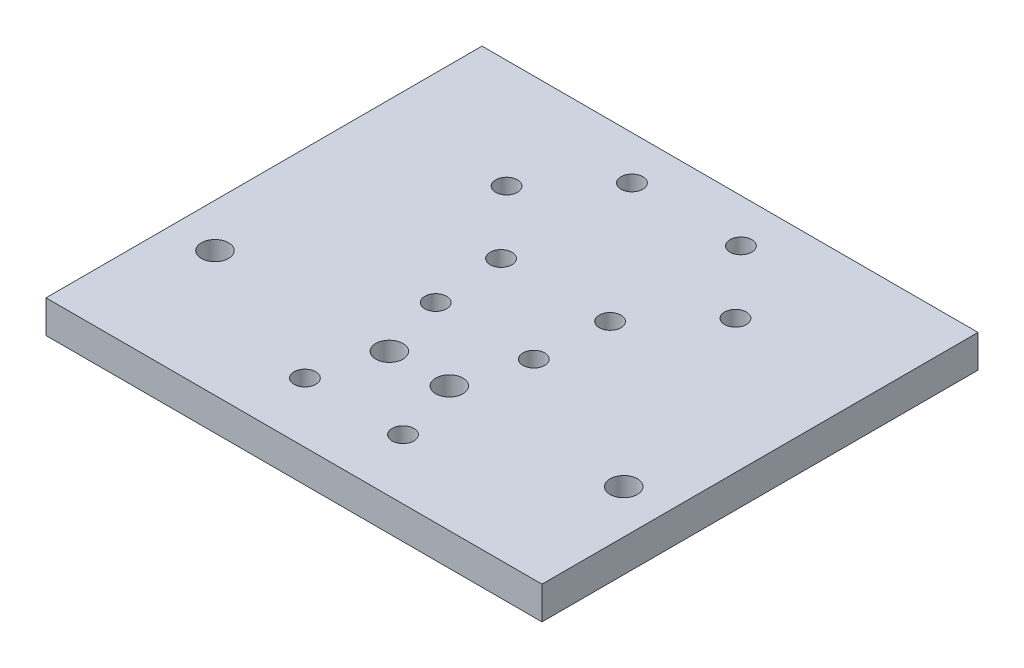
from build123d import *

# Parameters (mm, degrees)
EXTRUDE_1_DEPTH     = 104
SKETCH_2_R          = 2
SKETCH_2_R_2        = 2.5
SKETCH_2_W          = 6.5
SKETCH_2_H          = 80
CUT_EXTRUDE_1_DEPTH = 132.346869015


with BuildPart() as part:
    # 草图1 → 凸台-拉伸1 (new body)
    with BuildSketch(Plane(origin=(0, 0, 0), x_dir=(0, 0, -1), z_dir=(1, 0, 0))):
        Polygon((0, 0), (80, 0), (80, 6), (6, 6), (0, 6), align=None)
    extrude(amount=EXTRUDE_1_DEPTH)

    # 草图2 → 切除-拉伸1 (cut, through all)
    with BuildSketch(Plane(origin=(0, 6, 0), x_dir=(1, 0, 0), z_dir=(0, 1, 0))):
        with Locations(Location((43, 11, 0), (0, 0, 270))):
            Circle(SKETCH_2_R)
        with Locations(Location((43, 35, 0), (0, 0, 270))):
            Circle(SKETCH_2_R)
        with Locations(Location((42, 48, 0), (0, 0, 270))):
            Circle(SKETCH_2_R)
        with Locations(Location((42, 72, 0), (0, 0, 270))):
            Circle(SKETCH_2_R)
        with Locations(Location((62, 72, 0), (0, 0, 90))):
            Circle(SKETCH_2_R)
        with Locations(Location((62, 48, 0), (0, 0, 90))):
            Circle(SKETCH_2_R)
        with Locations(Location((61, 35, 0), (0, 0, 90))):
            Circle(SKETCH_2_R)
        with Locations(Location((61, 11, 0), (0, 0, 90))):
            Circle(SKETCH_2_R)
        with Locations(Location((57.5, 23, 0), (0, 0, 270))):
            Circle(SKETCH_2_R_2)
        with Locations(Location((89.5, 23, 0), (0, 0, 270))):
            Circle(SKETCH_2_R_2)
        with Locations(Location((46.5, 23, 0), (0, 0, 90))):
            Circle(SKETCH_2_R_2)
        with Locations(Location((14.5, 23, 0), (0, 0, 90))):
            Circle(SKETCH_2_R_2)
        with Locations(Location((73, 60, 0), (0, 0, 270))):
            Circle(SKETCH_2_R)
        with Locations(Location((31, 60, 0), (0, 0, 270))):
            Circle(SKETCH_2_R)
        with Locations((100.75, 40)):
            Rectangle(SKETCH_2_W, SKETCH_2_H)
        with Locations((3.25, 40)):
            Rectangle(SKETCH_2_W, SKETCH_2_H)
    extrude(amount=-CUT_EXTRUDE_1_DEPTH, mode=Mode.SUBTRACT)


solid = part.part
